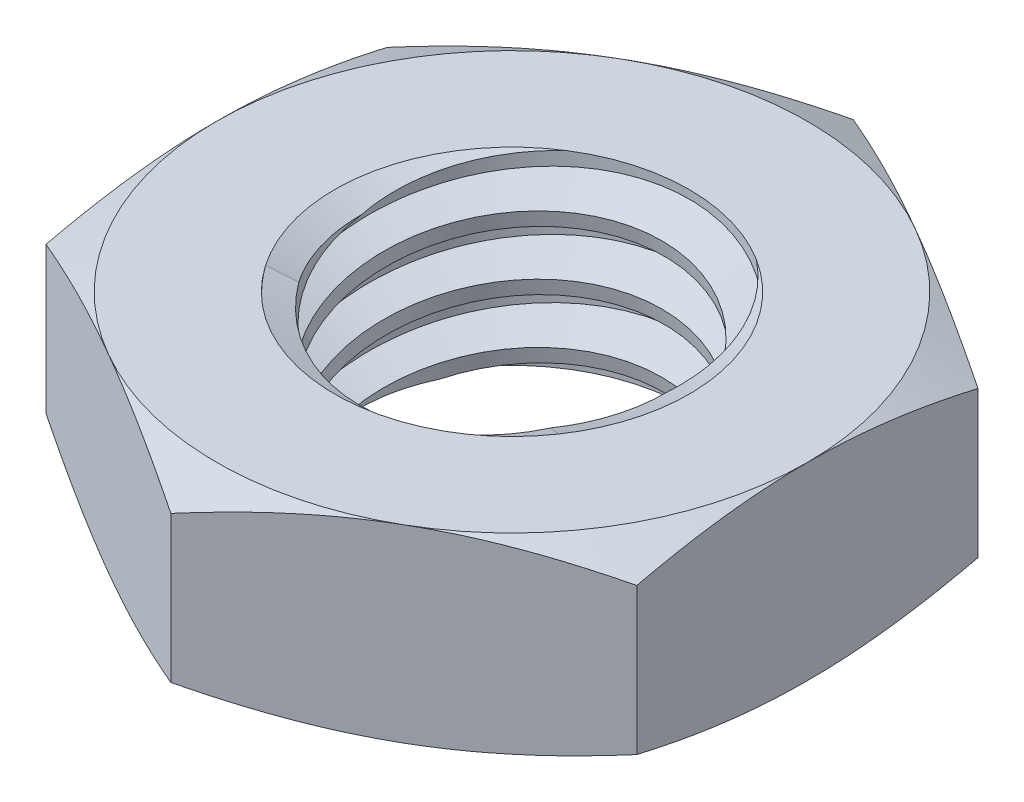
from build123d import *

# Parameters (mm, degrees)
EXTRUDE1_DEPTH      = 1.6
SKETCH2_W           = 3
SKETCH2_H           = 3.2
LPATTERN1_COUNT     = 3
LPATTERN1_PITCH     = 1
LPATTERN1_COL_COUNT = 2
LPATTERN1_COL_PITCH = 1


with BuildPart() as part:
    # Sketch1 → Extrude1 (new, symmetric)
    with BuildSketch(Plane(origin=(0, 0, 0), x_dir=(1, 0, 0), z_dir=(0, 1, 0))):
        Polygon((0, 5.773502692), (-5, 2.886751346), (-5, -2.886751346), (0, -5.773502692), (5, -2.886751346), (5, 2.886751346), align=None)
    extrude(amount=EXTRUDE1_DEPTH, both=True)

    # Sketch4 → Cut-Revolve2 (revolve, cut)
    with BuildSketch(Plane(origin=(0, 0, 0), x_dir=(0, 0, -1), z_dir=(1, 0, 0))):
        Polygon((0, 1.6), (3, 1.6), (2.538023184, 1.384576673), (2.538023184, -1.384576673), (3, -1.6), (0, -1.6), align=None)
    revolve(axis=Axis((0, 1.6, 0), (0, 1, 0)), mode=Mode.SUBTRACT)


with BuildPart() as body_2:
    # Sketch2 → Revolve1 (revolve)
    with BuildSketch(Plane(origin=(0, 0, 0), x_dir=(0, 0, -1), z_dir=(1, 0, 0))):
        with Locations((1.5, 0)):
            Rectangle(SKETCH2_W, SKETCH2_H)
    revolve(axis=Axis((0, -4.6, 0), (0, 1, 0)))

    # Sketch3 → Cut-Revolve1 (revolve, cut)
    with BuildSketch(Plane(origin=(0, 0, 0), x_dir=(0, 0, -1), z_dir=(1, 0, 0)), mode=Mode.PRIVATE) as cut_revolve1_sk:
        Polygon((3.020549873, 1.47670076), (3.164398987, 0.613606076), (2.579122931, 0.832870615), (2.538023184, 1.079469096), align=None)
    cut_revolve1 = revolve(cut_revolve1_sk.sketch.rotate(Axis((0, 1.6, 0.178376498), (0, -0.9863939238321437, -0.16439898730535754)), 180), axis=Axis((0, 1.6, 0.178376498), (0, -0.9863939238321437, -0.16439898730535754)), mode=Mode.SUBTRACT)

    # LPattern1: Cut-Revolve1 ×3
    with Locations(*[(0, -i * LPATTERN1_PITCH, 0) for i in range(1, LPATTERN1_COUNT)]):
        add(cut_revolve1, mode=Mode.SUBTRACT)

    # LPattern1 col: Cut-Revolve1 ×2
    with Locations(*[(0, i * LPATTERN1_COL_PITCH, 0) for i in range(1, LPATTERN1_COL_COUNT)]):
        add(cut_revolve1, mode=Mode.SUBTRACT)


with BuildPart() as part_1:
    add(part.part)

    # Combine1: cut body 2
    add(body_2.part, mode=Mode.SUBTRACT)

    # Sketch5 → Cut-Revolve3 (revolve, cut)
    with BuildSketch(Plane(origin=(0, 0, 0), x_dir=(0, 0, -1), z_dir=(1, 0, 0)), mode=Mode.PRIVATE) as cut_revolve3_sk:
        Polygon((0, -1.6), (5, -1.6), (5.773502692, -1.239309771), (5.773502692, 1.239309771), (5, 1.6), (0, 1.6), (0, 2.87), (7.043502692, 2.87), (7.043502692, -2.87), (0, -2.87), align=None)
    revolve(cut_revolve3_sk.sketch.rotate(Axis((0, -1.6, 0), (0, 1, 0)), 55.157981045), axis=Axis((0, -1.6, 0), (0, 1, 0)), mode=Mode.SUBTRACT)


solid = part_1.part
